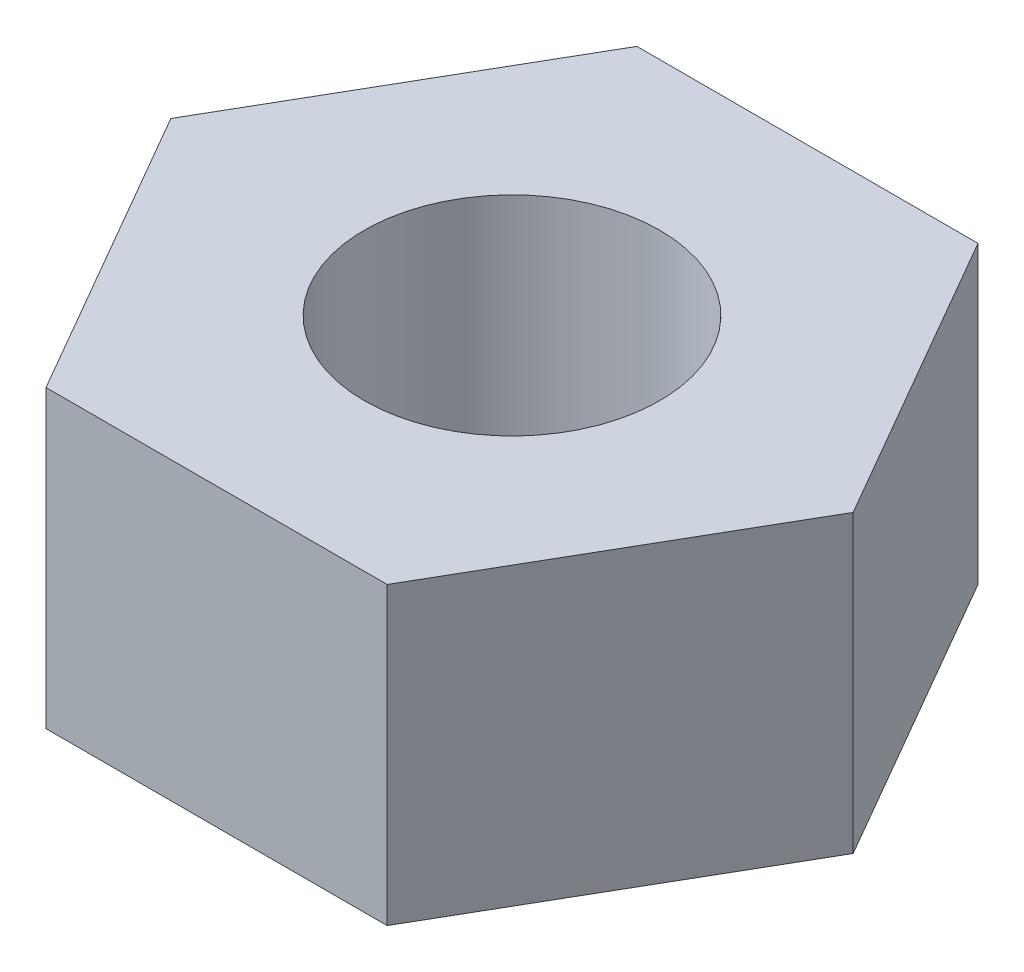
from build123d import *

# Parameters (mm, degrees)
SKETCH_1_R      = 0.5
EXTRUDE_1_DEPTH = 1


with BuildPart() as part:
    # 草图1 → 凸台-拉伸1 (new body)
    with BuildSketch(Plane(origin=(0, 0, 0), x_dir=(1, 0, 0), z_dir=(0, 1, 0))):
        Polygon((1.154700538, 0), (0.577350269, 1), (-0.577350269, 1), (-1.154700538, 0), (-0.577350269, -1), (0.577350269, -1), align=None)
        with Locations(Location((0, 0, 0), (0, 0, 270))):
            Circle(SKETCH_1_R, mode=Mode.SUBTRACT)
    extrude(amount=EXTRUDE_1_DEPTH)


solid = part.part
